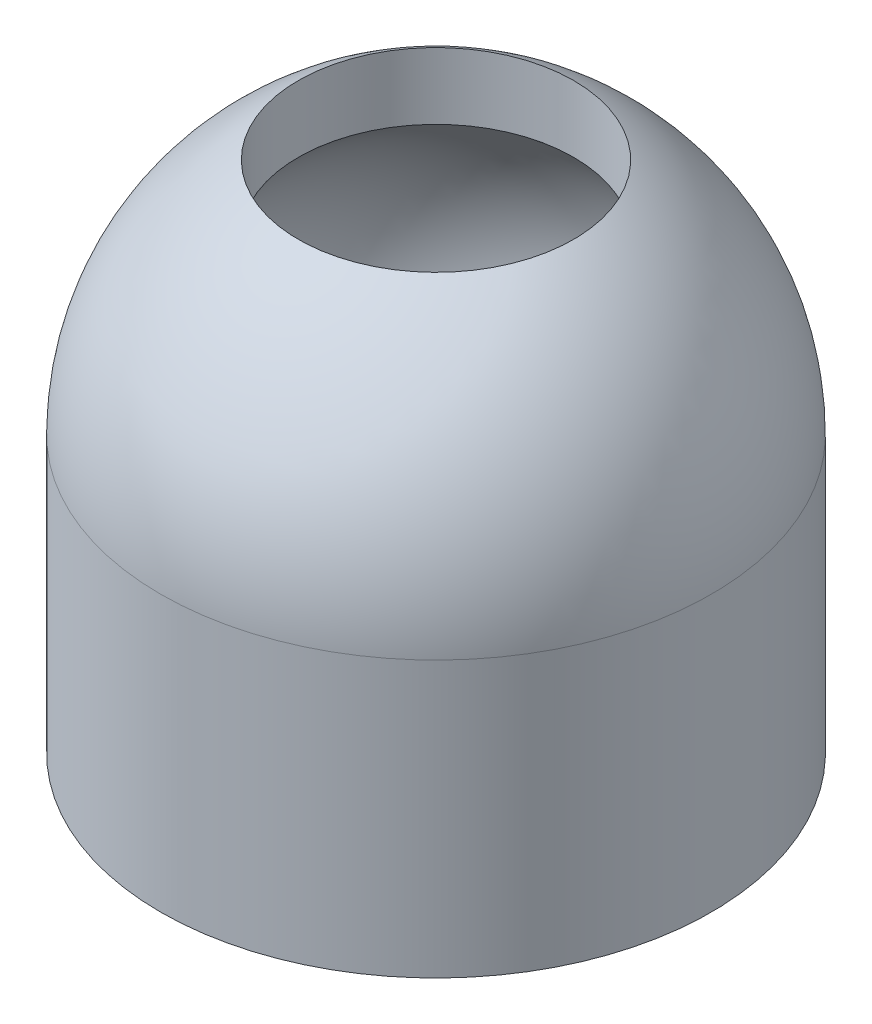
from build123d import *

# Parameters (mm, degrees)
SKETCH3_R          = 2.5
CUT_EXTRUDE1_DEPTH = 3


with BuildPart() as part:
    # Sketch1 → Revolve2 (revolve)
    with BuildSketch(Plane.XY):
        with BuildLine():
            ThreePointArc((0, -5), (5, 0), (0, 5))
            Line((0, 5), (0, -5))
        make_face()
        with BuildLine():
            ThreePointArc((5, 0), (3.535533906, -3.535533906), (0, -5))
            Line((0, -5), (5, -5))
            Line((5, -5), (5, 0))
        make_face()
    revolve(axis=Axis((0, 5, 0), (0, -1, 0)))

    # Sketch2 → Cut-Revolve1 (revolve, cut)
    with BuildSketch(Plane.XY):
        with BuildLine():
            Line((0, 4), (0, -4))
            ThreePointArc((0, -4), (4, 0), (0, 4))
        make_face()
    revolve(axis=Axis((0, 4, 0), (0, -1, 0)), mode=Mode.SUBTRACT)

    # Sketch3 → Cut-Extrude1 (cut)
    with BuildSketch(Plane(origin=(0, 5, 0), x_dir=(1, 0, 0), z_dir=(0, 1, 0))):
        with Locations(Location((0, 0, 0), (0, 0, 90))):
            Circle(SKETCH3_R)
    extrude(amount=-CUT_EXTRUDE1_DEPTH, mode=Mode.SUBTRACT)


solid = part.part
